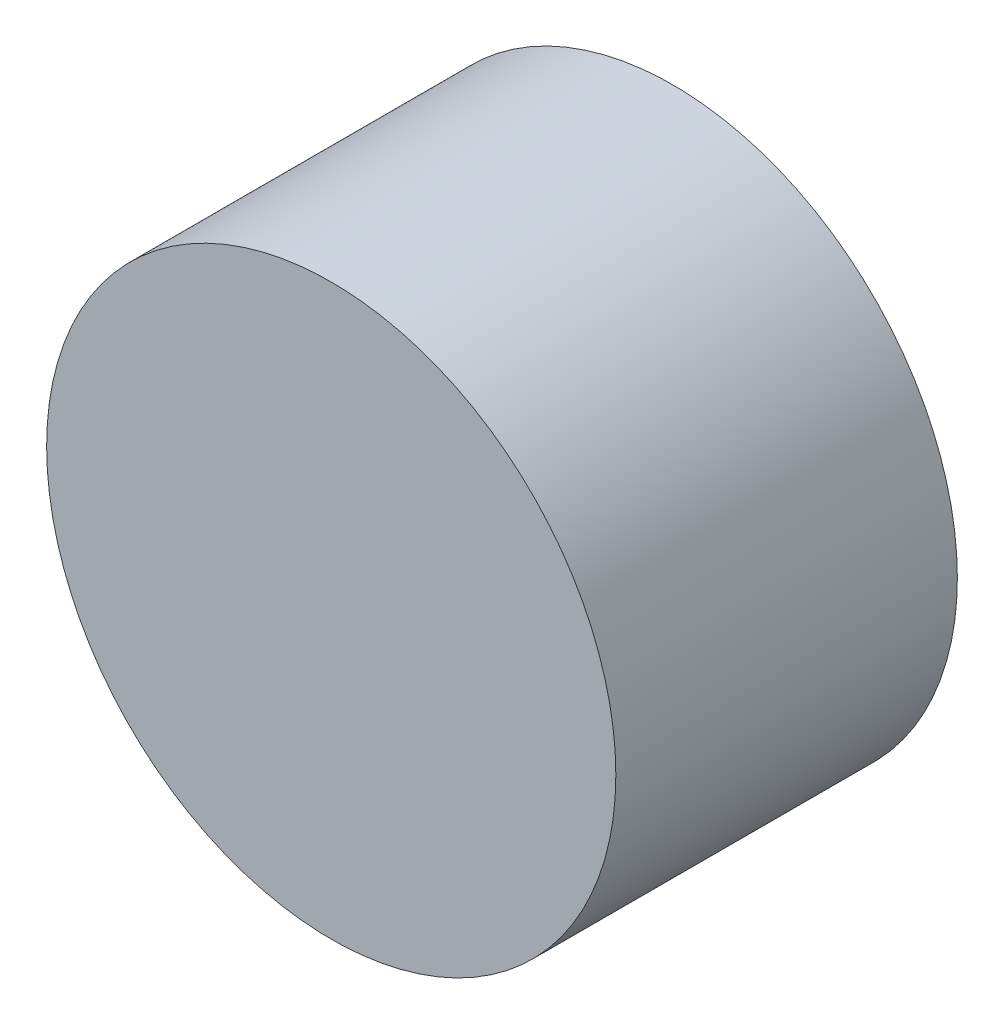
from build123d import *

# Parameters (mm, degrees)
CROQUIS1_R              = 2.5
SALIENTE_EXTRUIR1_DEPTH = 3


with BuildPart() as part:
    # Croquis1 → Saliente-Extruir1 (new body)
    with BuildSketch(Plane.XY):
        Circle(CROQUIS1_R)
    extrude(amount=SALIENTE_EXTRUIR1_DEPTH)


solid = part.part
